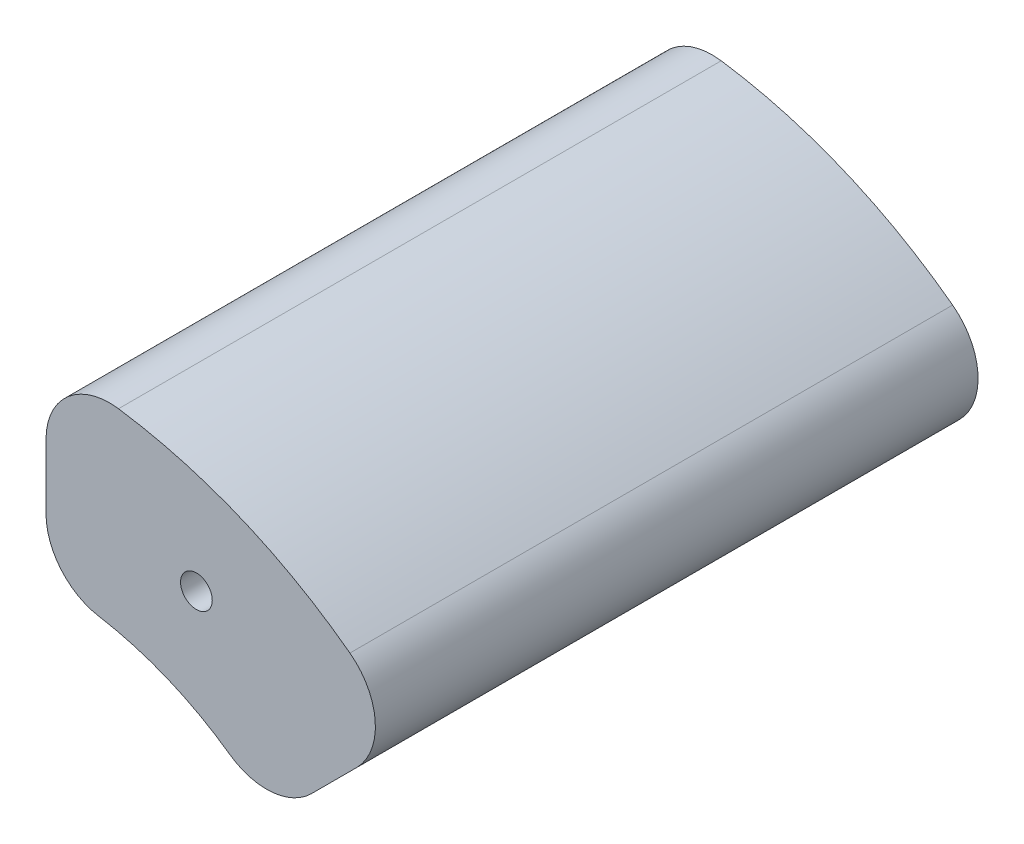
from build123d import *

# Parameters (mm, degrees)
SKETCH_1_R      = 2.5
EXTRUDE_1_DEPTH = 95
FILLET_1_R      = 10


with BuildPart() as part:
    # 草图1 → 凸台-拉伸1 (new body)
    with BuildSketch(Plane.XY):
        with BuildLine():
            Line((0, 50), (0, 80))
            ThreePointArc((0, 80), (30.614674589, 73.910362601), (56.568542495, 56.568542495))
            Line((56.568542495, 56.568542495), (35.355339059, 35.355339059))
            ThreePointArc((35.355339059, 35.355339059), (19.134171618, 46.193976626), (0, 50))
        make_face()
        with Locations((23.70806473, 60.410770511)):
            Circle(SKETCH_1_R, mode=Mode.SUBTRACT)
    extrude(amount=EXTRUDE_1_DEPTH)

    # 圆角1
    fillet_1_edges = [part.edges().sort_by_distance(p)[0] for p in [
        (56.568542495, 56.568542495, 47.5),
        (35.355339059, 35.355339059, 47.5),
        (0, 50, 47.5),
        (0, 80, 47.5),
    ]]
    fillet(fillet_1_edges, radius=FILLET_1_R)


solid = part.part
